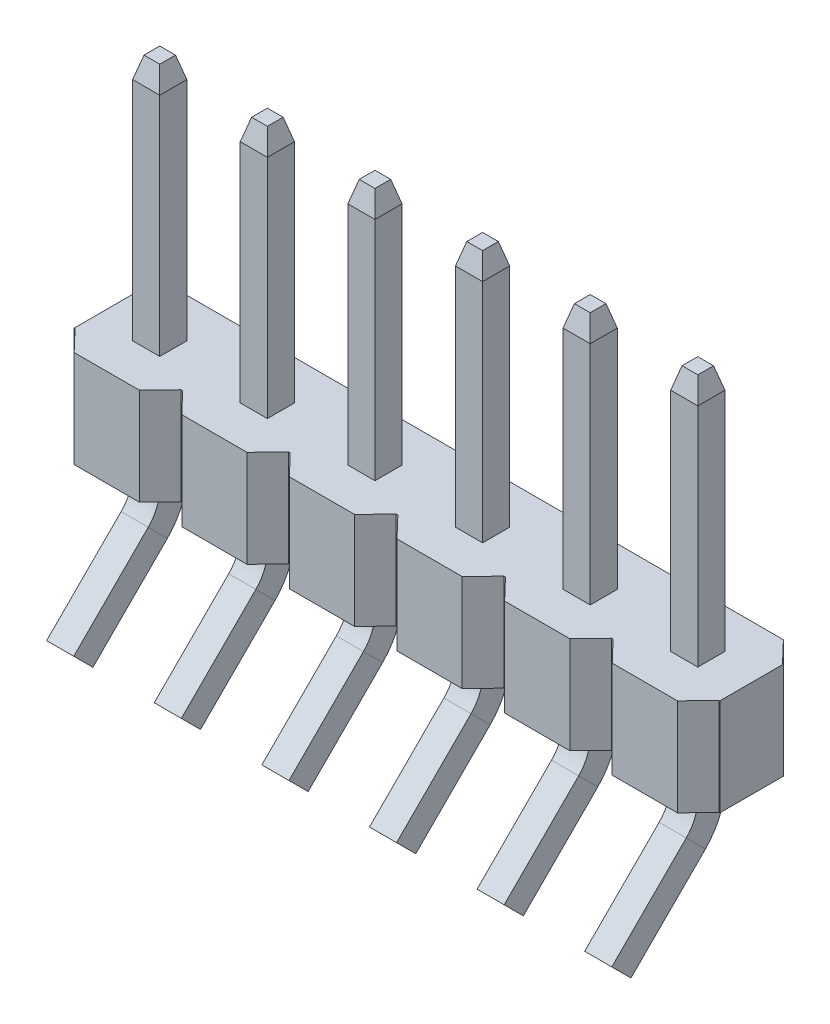
from build123d import *
from OCP.BRepFilletAPI import BRepFilletAPI_MakeChamfer

# Parameters (mm, degrees)
BOSS_EXTRUDE1_DEPTH         = 2.29
SKETCH3_W                   = 0.64
SKETCH3_H                   = 0.64
CHAMFER3_SIZE               = 0.5
CHAMFER3_SIZE2              = 0.133974596
LPATTERN1_COUNT             = 6
LPATTERN1_PITCH             = 2.54
CHAMFER3_OF_LPATTERN1_SIZE  = 0.5
CHAMFER3_OF_LPATTERN1_SIZE2 = 0.133974596


with BuildPart() as part:
    # Sketch1 → Boss-Extrude1 (new body)
    with BuildSketch(Plane(origin=(0, 0, 0), x_dir=(1, 0, 0), z_dir=(0, 1, 0))):
        Polygon((-0.77, 1.25), (0.77, 1.25), (1.25, 0.75), (1.27, 0.75), (1.27, -0.75), (1.25, -0.75), (0.77, -1.25), (-0.77, -1.25), (-1.25, -0.75), (-1.27, -0.75), (-1.27, 0.75), (-1.25, 0.75), align=None)
    boss_extrude1 = extrude(amount=BOSS_EXTRUDE1_DEPTH)

    # Sweep1: sweep along a path in Sketch2
    with BuildLine(Plane(origin=(0, 0, 0), x_dir=(0, 0, -1), z_dir=(1, 0, 0))) as sweep1_path:
        Line((0, 8.13), (0, -0.408142235))
        ThreePointArc((0, -0.408142235), (-0.095150584, -0.886496526), (-0.366116524, -1.292025712))
        Line((-0.366116524, -1.292025712), (-2.124090812, -3.05))
    # Sketch3 → Sweep1 (sweep)
    with BuildSketch(Plane(origin=(0, 8.13, 0), x_dir=(1, 0, 0), z_dir=(0, 1, 0))):
        Rectangle(SKETCH3_W, SKETCH3_H)
    sweep1 = sweep(path=sweep1_path.line)

    # Chamfer3: one chamfer whose edges measure the first distance from different faces: ONE call of the kernel's chamfer builder (chamfer() names one face for all edges)
    chamfer3_edges_1 = [part.edges().sort_by_distance(p)[0] for p in [
        (0.32, 8.13, 0),
    ]]
    chamfer3_side_1 = [part.faces().sort_by_distance(p)[0] for p in [
        (0.32, 5.21, 0),
    ]]
    chamfer3_edges_2 = [part.edges().sort_by_distance(p)[0] for p in [
        (0, 8.13, -0.32),
    ]]
    chamfer3_side_2 = [part.faces().sort_by_distance(p)[0] for p in [
        (0, 5.21, -0.32),
    ]]
    chamfer3_edges_3 = [part.edges().sort_by_distance(p)[0] for p in [
        (-0.32, 8.13, 0),
    ]]
    chamfer3_side_3 = [part.faces().sort_by_distance(p)[0] for p in [
        (-0.32, 5.21, 0),
    ]]
    chamfer3_edges_4 = [part.edges().sort_by_distance(p)[0] for p in [
        (0, 8.13, 0.32),
    ]]
    chamfer3_side_4 = [part.faces().sort_by_distance(p)[0] for p in [
        (0, 5.21, 0.32),
    ]]
    chamfer3 = BRepFilletAPI_MakeChamfer(part.part.solid().wrapped)
    for e in chamfer3_edges_1:
        chamfer3.Add(CHAMFER3_SIZE, CHAMFER3_SIZE2, e.wrapped, chamfer3_side_1[0].wrapped)  # the first distance lies on this face
    for e in chamfer3_edges_2:
        chamfer3.Add(CHAMFER3_SIZE, CHAMFER3_SIZE2, e.wrapped, chamfer3_side_2[0].wrapped)  # the first distance lies on this face
    for e in chamfer3_edges_3:
        chamfer3.Add(CHAMFER3_SIZE, CHAMFER3_SIZE2, e.wrapped, chamfer3_side_3[0].wrapped)  # the first distance lies on this face
    for e in chamfer3_edges_4:
        chamfer3.Add(CHAMFER3_SIZE, CHAMFER3_SIZE2, e.wrapped, chamfer3_side_4[0].wrapped)  # the first distance lies on this face
    add(Compound.cast(chamfer3.Shape()), mode=Mode.REPLACE)

    # LPattern1: Boss-Extrude1, Sweep1 ×6
    with Locations(*[(i * LPATTERN1_PITCH, 0, 0) for i in range(1, LPATTERN1_COUNT)]):
        add(boss_extrude1)
        add(sweep1)

    # Chamfer3 of LPattern1: one chamfer whose edges measure the first distance from different faces: ONE call of the kernel's chamfer builder (chamfer() names one face for all edges)
    chamfer3_of_lpattern1_edges_1 = [part.edges().sort_by_distance(p)[0] for p in [
        (2.86, 8.13, 0),
    ]]
    chamfer3_of_lpattern1_side_1 = [part.faces().sort_by_distance(p)[0] for p in [
        (2.86, 5.21, 0),
    ]]
    chamfer3_of_lpattern1_edges_2 = [part.edges().sort_by_distance(p)[0] for p in [
        (2.54, 8.13, -0.32),
    ]]
    chamfer3_of_lpattern1_side_2 = [part.faces().sort_by_distance(p)[0] for p in [
        (2.54, 5.21, -0.32),
    ]]
    chamfer3_of_lpattern1_edges_3 = [part.edges().sort_by_distance(p)[0] for p in [
        (2.22, 8.13, 0),
    ]]
    chamfer3_of_lpattern1_side_3 = [part.faces().sort_by_distance(p)[0] for p in [
        (2.22, 5.21, 0),
    ]]
    chamfer3_of_lpattern1_edges_4 = [part.edges().sort_by_distance(p)[0] for p in [
        (2.54, 8.13, 0.32),
    ]]
    chamfer3_of_lpattern1_side_4 = [part.faces().sort_by_distance(p)[0] for p in [
        (2.54, 5.21, 0.32),
    ]]
    chamfer3_of_lpattern1_edges_5 = [part.edges().sort_by_distance(p)[0] for p in [
        (5.4, 8.13, 0),
    ]]
    chamfer3_of_lpattern1_side_5 = [part.faces().sort_by_distance(p)[0] for p in [
        (5.4, 5.21, 0),
    ]]
    chamfer3_of_lpattern1_edges_6 = [part.edges().sort_by_distance(p)[0] for p in [
        (5.08, 8.13, -0.32),
    ]]
    chamfer3_of_lpattern1_side_6 = [part.faces().sort_by_distance(p)[0] for p in [
        (5.08, 5.21, -0.32),
    ]]
    chamfer3_of_lpattern1_edges_7 = [part.edges().sort_by_distance(p)[0] for p in [
        (4.76, 8.13, 0),
    ]]
    chamfer3_of_lpattern1_side_7 = [part.faces().sort_by_distance(p)[0] for p in [
        (4.76, 5.21, 0),
    ]]
    chamfer3_of_lpattern1_edges_8 = [part.edges().sort_by_distance(p)[0] for p in [
        (5.08, 8.13, 0.32),
    ]]
    chamfer3_of_lpattern1_side_8 = [part.faces().sort_by_distance(p)[0] for p in [
        (5.08, 5.21, 0.32),
    ]]
    chamfer3_of_lpattern1_edges_9 = [part.edges().sort_by_distance(p)[0] for p in [
        (7.94, 8.13, 0),
    ]]
    chamfer3_of_lpattern1_side_9 = [part.faces().sort_by_distance(p)[0] for p in [
        (7.94, 5.21, 0),
    ]]
    chamfer3_of_lpattern1_edges_10 = [part.edges().sort_by_distance(p)[0] for p in [
        (7.62, 8.13, -0.32),
    ]]
    chamfer3_of_lpattern1_side_10 = [part.faces().sort_by_distance(p)[0] for p in [
        (7.62, 5.21, -0.32),
    ]]
    chamfer3_of_lpattern1_edges_11 = [part.edges().sort_by_distance(p)[0] for p in [
        (7.3, 8.13, 0),
    ]]
    chamfer3_of_lpattern1_side_11 = [part.faces().sort_by_distance(p)[0] for p in [
        (7.3, 5.21, 0),
    ]]
    chamfer3_of_lpattern1_edges_12 = [part.edges().sort_by_distance(p)[0] for p in [
        (7.62, 8.13, 0.32),
    ]]
    chamfer3_of_lpattern1_side_12 = [part.faces().sort_by_distance(p)[0] for p in [
        (7.62, 5.21, 0.32),
    ]]
    chamfer3_of_lpattern1_edges_13 = [part.edges().sort_by_distance(p)[0] for p in [
        (10.48, 8.13, 0),
    ]]
    chamfer3_of_lpattern1_side_13 = [part.faces().sort_by_distance(p)[0] for p in [
        (10.48, 5.21, 0),
    ]]
    chamfer3_of_lpattern1_edges_14 = [part.edges().sort_by_distance(p)[0] for p in [
        (10.16, 8.13, -0.32),
    ]]
    chamfer3_of_lpattern1_side_14 = [part.faces().sort_by_distance(p)[0] for p in [
        (10.16, 5.21, -0.32),
    ]]
    chamfer3_of_lpattern1_edges_15 = [part.edges().sort_by_distance(p)[0] for p in [
        (9.84, 8.13, 0),
    ]]
    chamfer3_of_lpattern1_side_15 = [part.faces().sort_by_distance(p)[0] for p in [
        (9.84, 5.21, 0),
    ]]
    chamfer3_of_lpattern1_edges_16 = [part.edges().sort_by_distance(p)[0] for p in [
        (10.16, 8.13, 0.32),
    ]]
    chamfer3_of_lpattern1_side_16 = [part.faces().sort_by_distance(p)[0] for p in [
        (10.16, 5.21, 0.32),
    ]]
    chamfer3_of_lpattern1_edges_17 = [part.edges().sort_by_distance(p)[0] for p in [
        (13.02, 8.13, 0),
    ]]
    chamfer3_of_lpattern1_side_17 = [part.faces().sort_by_distance(p)[0] for p in [
        (13.02, 5.21, 0),
    ]]
    chamfer3_of_lpattern1_edges_18 = [part.edges().sort_by_distance(p)[0] for p in [
        (12.7, 8.13, -0.32),
    ]]
    chamfer3_of_lpattern1_side_18 = [part.faces().sort_by_distance(p)[0] for p in [
        (12.7, 5.21, -0.32),
    ]]
    chamfer3_of_lpattern1_edges_19 = [part.edges().sort_by_distance(p)[0] for p in [
        (12.38, 8.13, 0),
    ]]
    chamfer3_of_lpattern1_side_19 = [part.faces().sort_by_distance(p)[0] for p in [
        (12.38, 5.21, 0),
    ]]
    chamfer3_of_lpattern1_edges_20 = [part.edges().sort_by_distance(p)[0] for p in [
        (12.7, 8.13, 0.32),
    ]]
    chamfer3_of_lpattern1_side_20 = [part.faces().sort_by_distance(p)[0] for p in [
        (12.7, 5.21, 0.32),
    ]]
    chamfer3_of_lpattern1 = BRepFilletAPI_MakeChamfer(part.part.solid().wrapped)
    for e in chamfer3_of_lpattern1_edges_1:
        chamfer3_of_lpattern1.Add(CHAMFER3_OF_LPATTERN1_SIZE, CHAMFER3_OF_LPATTERN1_SIZE2, e.wrapped, chamfer3_of_lpattern1_side_1[0].wrapped)  # the first distance lies on this face
    for e in chamfer3_of_lpattern1_edges_2:
        chamfer3_of_lpattern1.Add(CHAMFER3_OF_LPATTERN1_SIZE, CHAMFER3_OF_LPATTERN1_SIZE2, e.wrapped, chamfer3_of_lpattern1_side_2[0].wrapped)  # the first distance lies on this face
    for e in chamfer3_of_lpattern1_edges_3:
        chamfer3_of_lpattern1.Add(CHAMFER3_OF_LPATTERN1_SIZE, CHAMFER3_OF_LPATTERN1_SIZE2, e.wrapped, chamfer3_of_lpattern1_side_3[0].wrapped)  # the first distance lies on this face
    for e in chamfer3_of_lpattern1_edges_4:
        chamfer3_of_lpattern1.Add(CHAMFER3_OF_LPATTERN1_SIZE, CHAMFER3_OF_LPATTERN1_SIZE2, e.wrapped, chamfer3_of_lpattern1_side_4[0].wrapped)  # the first distance lies on this face
    for e in chamfer3_of_lpattern1_edges_5:
        chamfer3_of_lpattern1.Add(CHAMFER3_OF_LPATTERN1_SIZE, CHAMFER3_OF_LPATTERN1_SIZE2, e.wrapped, chamfer3_of_lpattern1_side_5[0].wrapped)  # the first distance lies on this face
    for e in chamfer3_of_lpattern1_edges_6:
        chamfer3_of_lpattern1.Add(CHAMFER3_OF_LPATTERN1_SIZE, CHAMFER3_OF_LPATTERN1_SIZE2, e.wrapped, chamfer3_of_lpattern1_side_6[0].wrapped)  # the first distance lies on this face
    for e in chamfer3_of_lpattern1_edges_7:
        chamfer3_of_lpattern1.Add(CHAMFER3_OF_LPATTERN1_SIZE, CHAMFER3_OF_LPATTERN1_SIZE2, e.wrapped, chamfer3_of_lpattern1_side_7[0].wrapped)  # the first distance lies on this face
    for e in chamfer3_of_lpattern1_edges_8:
        chamfer3_of_lpattern1.Add(CHAMFER3_OF_LPATTERN1_SIZE, CHAMFER3_OF_LPATTERN1_SIZE2, e.wrapped, chamfer3_of_lpattern1_side_8[0].wrapped)  # the first distance lies on this face
    for e in chamfer3_of_lpattern1_edges_9:
        chamfer3_of_lpattern1.Add(CHAMFER3_OF_LPATTERN1_SIZE, CHAMFER3_OF_LPATTERN1_SIZE2, e.wrapped, chamfer3_of_lpattern1_side_9[0].wrapped)  # the first distance lies on this face
    for e in chamfer3_of_lpattern1_edges_10:
        chamfer3_of_lpattern1.Add(CHAMFER3_OF_LPATTERN1_SIZE, CHAMFER3_OF_LPATTERN1_SIZE2, e.wrapped, chamfer3_of_lpattern1_side_10[0].wrapped)  # the first distance lies on this face
    for e in chamfer3_of_lpattern1_edges_11:
        chamfer3_of_lpattern1.Add(CHAMFER3_OF_LPATTERN1_SIZE, CHAMFER3_OF_LPATTERN1_SIZE2, e.wrapped, chamfer3_of_lpattern1_side_11[0].wrapped)  # the first distance lies on this face
    for e in chamfer3_of_lpattern1_edges_12:
        chamfer3_of_lpattern1.Add(CHAMFER3_OF_LPATTERN1_SIZE, CHAMFER3_OF_LPATTERN1_SIZE2, e.wrapped, chamfer3_of_lpattern1_side_12[0].wrapped)  # the first distance lies on this face
    for e in chamfer3_of_lpattern1_edges_13:
        chamfer3_of_lpattern1.Add(CHAMFER3_OF_LPATTERN1_SIZE, CHAMFER3_OF_LPATTERN1_SIZE2, e.wrapped, chamfer3_of_lpattern1_side_13[0].wrapped)  # the first distance lies on this face
    for e in chamfer3_of_lpattern1_edges_14:
        chamfer3_of_lpattern1.Add(CHAMFER3_OF_LPATTERN1_SIZE, CHAMFER3_OF_LPATTERN1_SIZE2, e.wrapped, chamfer3_of_lpattern1_side_14[0].wrapped)  # the first distance lies on this face
    for e in chamfer3_of_lpattern1_edges_15:
        chamfer3_of_lpattern1.Add(CHAMFER3_OF_LPATTERN1_SIZE, CHAMFER3_OF_LPATTERN1_SIZE2, e.wrapped, chamfer3_of_lpattern1_side_15[0].wrapped)  # the first distance lies on this face
    for e in chamfer3_of_lpattern1_edges_16:
        chamfer3_of_lpattern1.Add(CHAMFER3_OF_LPATTERN1_SIZE, CHAMFER3_OF_LPATTERN1_SIZE2, e.wrapped, chamfer3_of_lpattern1_side_16[0].wrapped)  # the first distance lies on this face
    for e in chamfer3_of_lpattern1_edges_17:
        chamfer3_of_lpattern1.Add(CHAMFER3_OF_LPATTERN1_SIZE, CHAMFER3_OF_LPATTERN1_SIZE2, e.wrapped, chamfer3_of_lpattern1_side_17[0].wrapped)  # the first distance lies on this face
    for e in chamfer3_of_lpattern1_edges_18:
        chamfer3_of_lpattern1.Add(CHAMFER3_OF_LPATTERN1_SIZE, CHAMFER3_OF_LPATTERN1_SIZE2, e.wrapped, chamfer3_of_lpattern1_side_18[0].wrapped)  # the first distance lies on this face
    for e in chamfer3_of_lpattern1_edges_19:
        chamfer3_of_lpattern1.Add(CHAMFER3_OF_LPATTERN1_SIZE, CHAMFER3_OF_LPATTERN1_SIZE2, e.wrapped, chamfer3_of_lpattern1_side_19[0].wrapped)  # the first distance lies on this face
    for e in chamfer3_of_lpattern1_edges_20:
        chamfer3_of_lpattern1.Add(CHAMFER3_OF_LPATTERN1_SIZE, CHAMFER3_OF_LPATTERN1_SIZE2, e.wrapped, chamfer3_of_lpattern1_side_20[0].wrapped)  # the first distance lies on this face
    add(Compound.cast(chamfer3_of_lpattern1.Shape()), mode=Mode.REPLACE)


solid = part.part
